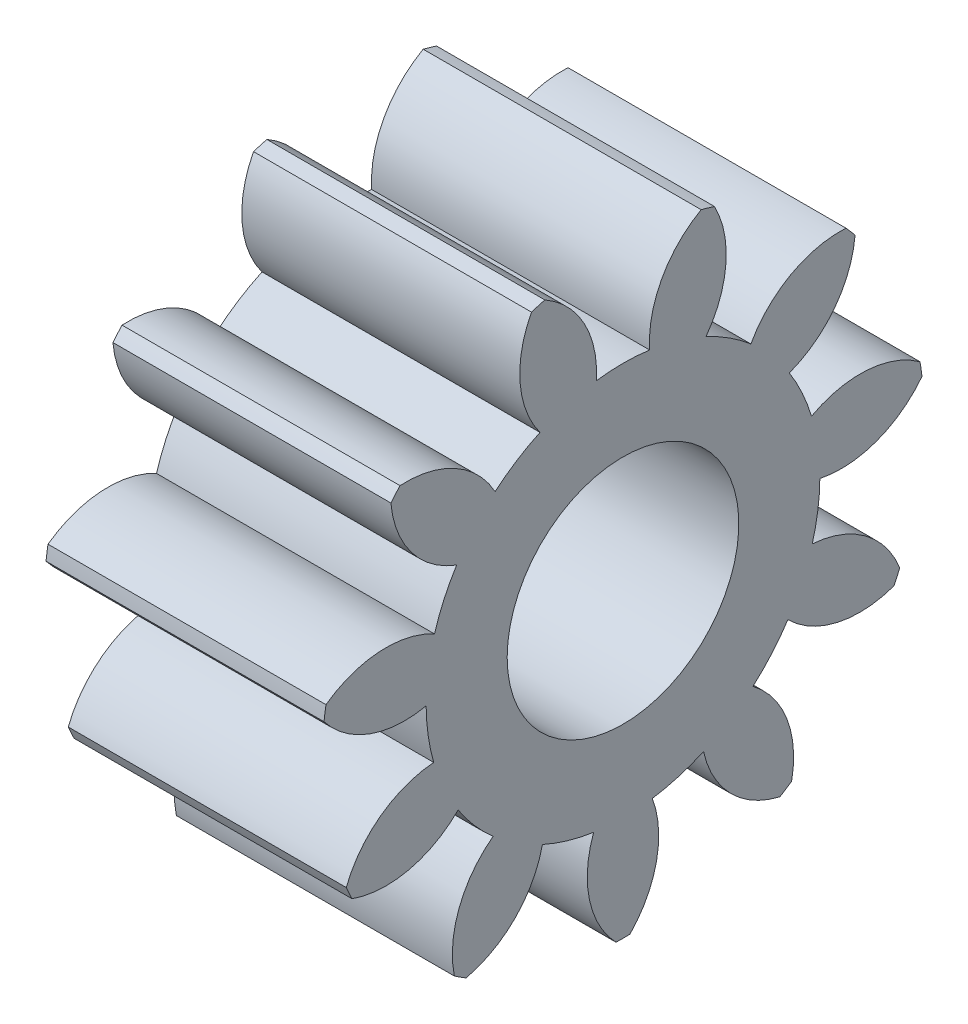
from build123d import *

# Parameters (mm, degrees)
BASPROSKE_W     = 6
BASPROSKE_H     = 6.5
TOOTHCUT_DEPTH  = 11.9772492
TEETHCUTS_COUNT = 11
TEETHCUTS_ANGLE = 327.272727273
BORSKE_R        = 2.5
BORE_DEPTH      = 50.0000508


with BuildPart() as part:
    # BasProSke → Base-Revolve (revolve)
    with BuildSketch(Plane(origin=(0, 0, 0), x_dir=(1, 0, 0), z_dir=(0, 1, 0)), mode=Mode.PRIVATE) as base_revolve_sk:
        with Locations((3, 3.25)):
            Rectangle(BASPROSKE_W, BASPROSKE_H)
    revolve(base_revolve_sk.sketch.rotate(Axis((-10, 0, 0), (1, 0, 0)), 180), axis=Axis((-10, 0, 0), (1, 0, 0)))

    # TooCutSke → ToothCut (cut, through all)
    with BuildSketch(Plane(origin=(0, 0, 0), x_dir=(0, 0, -1), z_dir=(1, 0, 0))):
        with BuildLine():
            ThreePointArc((0.576045815, 4.209771041), (0, 4.249), (-0.576045815, 4.209771041))
            ThreePointArc((-0.576045815, 4.209771041), (-0.841371334, 5.420048739), (-1.718652745, 6.295004202))
            ThreePointArc((-1.718652745, 6.295004202), (0, 6.5254), (1.718652745, 6.295004202))
            ThreePointArc((1.718652745, 6.295004202), (0.841371334, 5.420048739), (0.576045815, 4.209771041))
        make_face()
    toothcut = extrude(amount=TOOTHCUT_DEPTH, mode=Mode.SUBTRACT)

    # TeethCuts: ToothCut ×11 about axis
    teethcuts_axis = Axis((-10, 0, 0), (1, 0, 0))
    for i in range(1, TEETHCUTS_COUNT):
        add(toothcut.rotate(teethcuts_axis, i * TEETHCUTS_ANGLE / (TEETHCUTS_COUNT - 1)), mode=Mode.SUBTRACT)

    # BorSke → Bore (cut, symmetric)
    with BuildSketch(Plane(origin=(0, 0, 0), x_dir=(0, 0, -1), z_dir=(1, 0, 0))):
        with Locations(Location((0, 0, 0), (0, 0, 180))):
            Circle(BORSKE_R)
    extrude(amount=BORE_DEPTH, both=True, mode=Mode.SUBTRACT)


solid = part.part
